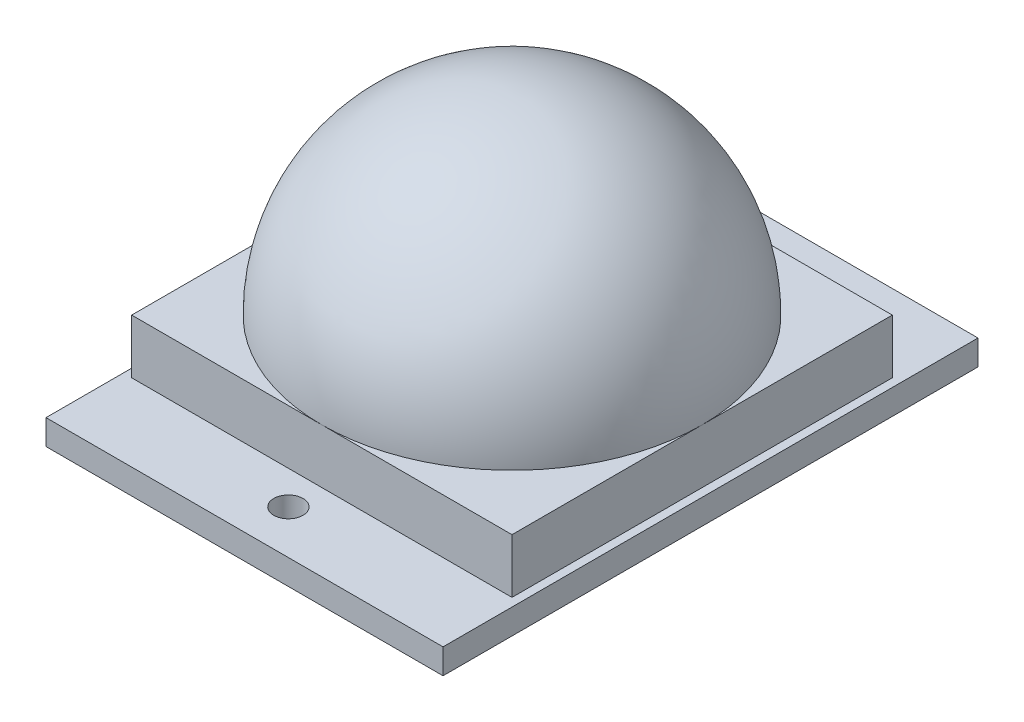
from build123d import *

# Parameters (mm, degrees)
SKETCH1_W           = 24.13
SKETCH1_H           = 32.512
BOSS_EXTRUDE1_DEPTH = 1.524
SKETCH2_W           = 23.114
SKETCH2_H           = 23.114
BOSS_EXTRUDE2_DEPTH = 3.302
SKETCH5_R           = 0.889
CUT_EXTRUDE1_DEPTH  = 26.11198204


with BuildPart() as part:
    # Sketch1 → Boss-Extrude1 (new body)
    with BuildSketch(Plane(origin=(0, 0, 0), x_dir=(1, 0, 0), z_dir=(0, 1, 0))):
        Rectangle(SKETCH1_W, SKETCH1_H)
    extrude(amount=BOSS_EXTRUDE1_DEPTH)

    # Sketch2 → Boss-Extrude2 (add)
    with BuildSketch(Plane(origin=(0, 1.524, 0), x_dir=(1, 0, 0), z_dir=(0, 1, 0))):
        Rectangle(SKETCH2_W, SKETCH2_H)
    extrude(amount=BOSS_EXTRUDE2_DEPTH)

    # Sketch4 → Revolve1 (revolve)
    with BuildSketch(Plane(origin=(0, 0, 0), x_dir=(0, 0, -1), z_dir=(1, 0, 0))):
        with BuildLine():
            Line((0, 4.826), (0, 16.383))
            ThreePointArc((0, 16.383), (-8.17203307, 12.99803307), (-11.557, 4.826))
            Line((-11.557, 4.826), (0, 4.826))
        make_face()
    revolve(axis=Axis((0, 4.826, 0), (0, 1, 0)))

    # Sketch5 → Cut-Extrude1 (cut, through all)
    with BuildSketch(Plane(origin=(0, 1.524, 0), x_dir=(1, 0, 0), z_dir=(0, 1, 0))):
        with Locations(Location((0, -13.589, 0), (0, 0, 270))):
            Circle(SKETCH5_R)
        with Locations(Location((0, 13.589, 0), (0, 0, 270))):
            Circle(SKETCH5_R)
    extrude(amount=-CUT_EXTRUDE1_DEPTH, mode=Mode.SUBTRACT)


solid = part.part
